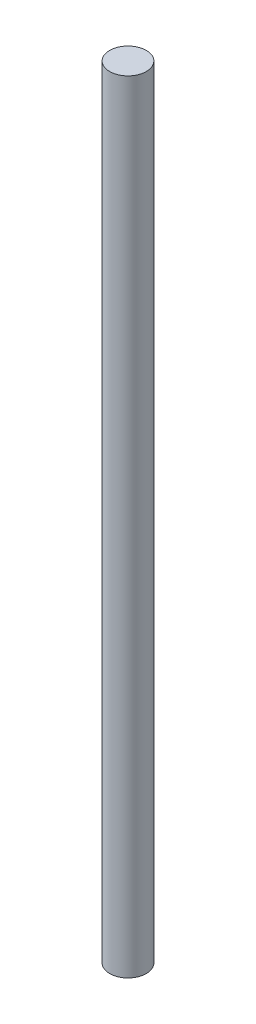
from build123d import *

# Parameters (mm, degrees)
SKIZZE1_R                       = 3
AUFSATZ_LINEAR_AUSTRAGEN1_DEPTH = 128


with BuildPart() as part:
    # Skizze1 → Aufsatz-Linear austragen1 (new body)
    with BuildSketch(Plane(origin=(0, 0, 0), x_dir=(-1, 0, 0), z_dir=(0, 1, 0))):
        with Locations(Location((0, 0, 0), (0, 0, 90))):
            Circle(SKIZZE1_R)
    extrude(amount=AUFSATZ_LINEAR_AUSTRAGEN1_DEPTH)


solid = part.part
